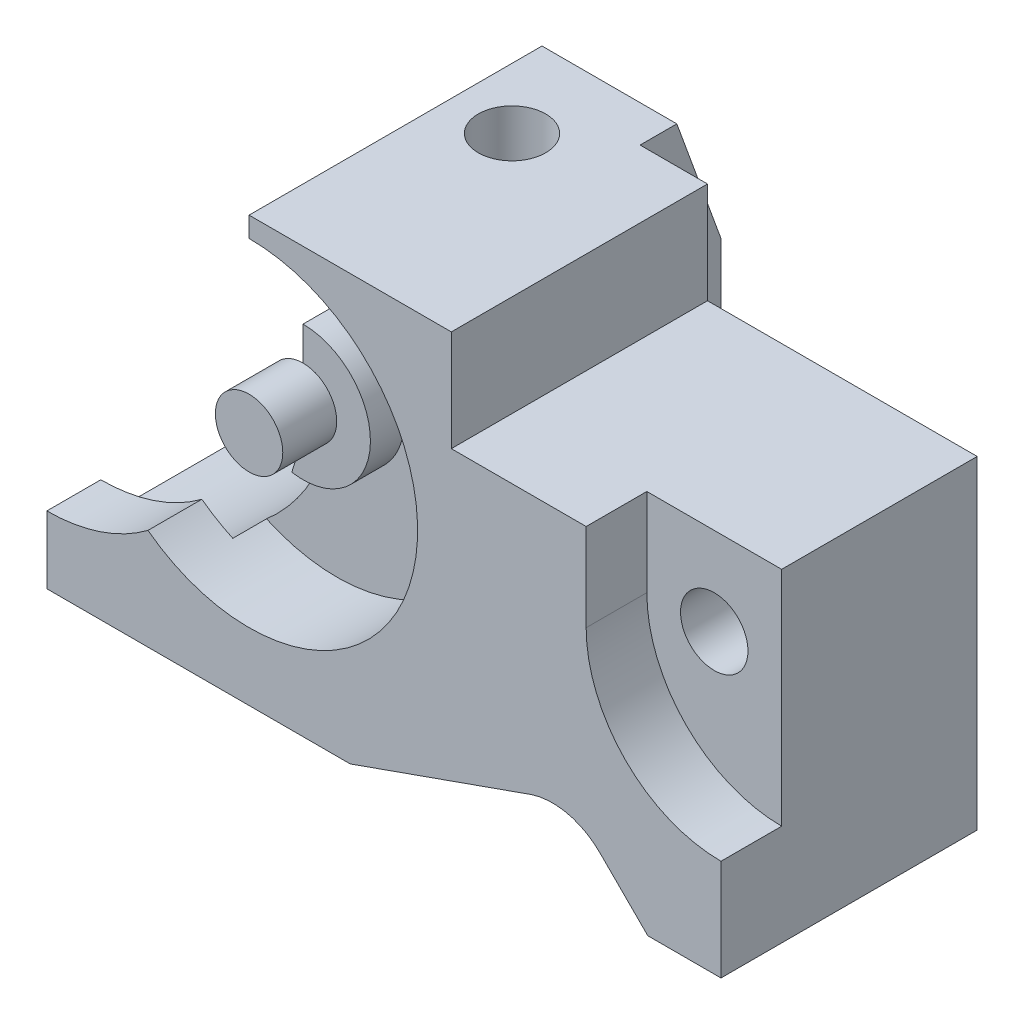
from build123d import *

# Parameters (mm, degrees)
BOSS_EXTRUDE1_DEPTH = 50
SKETCH3_R           = 5
CUT_EXTRUDE1_DEPTH  = 64
CUT_EXTRUDE2_DEPTH  = 9
SKETCH7_R           = 5
CUT_EXTRUDE3_DEPTH  = 82
SKETCH8_W           = 40
SKETCH8_H           = 12
CUT_EXTRUDE4_DEPTH  = 82
SKETCH9_W           = 10
SKETCH9_H           = 12
CUT_EXTRUDE5_DEPTH  = 82
CUT_EXTRUDE6_DEPTH  = 82
SKETCH11_R          = 25
CUT_EXTRUDE7_DEPTH  = 13
BOSS_EXTRUDE2_DEPTH = 8
BOSS_EXTRUDE3_DEPTH = 5
SKETCH14_R          = 5
BOSS_EXTRUDE4_DEPTH = 8


with BuildPart() as part:
    # Sketch1 → Boss-Extrude1 (new body)
    with BuildSketch(Plane.XY):
        with BuildLine():
            Line((0, 5), (0, 0))
            Line((0, 0), (45, 0))
            Line((45, 0), (71.869067897, 9.497224024))
            ThreePointArc((71.869067897, 9.497224024), (77.313595869, 9.728683064), (82.071067812, 7.071067812))
            Line((82.071067812, 7.071067812), (89.142135624, 0))
            Line((89.142135624, 0), (100, 0))
            Line((100, 0), (100, 48))
            Line((100, 48), (60, 48))
            Line((60, 48), (60, 63))
            Line((60, 63), (30, 63))
            Line((30, 63), (30, 35))
            ThreePointArc((30, 35), (21.213203436, 13.786796564), (0, 5))
        make_face()
    extrude(amount=BOSS_EXTRUDE1_DEPTH)

    # Sketch3 → Cut-Extrude1 (cut)
    with BuildSketch(Plane.XY.offset(50)):
        with Locations((90, 35)):
            Circle(SKETCH3_R)
    extrude(amount=-CUT_EXTRUDE1_DEPTH, mode=Mode.SUBTRACT)

    # Sketch6 → Cut-Extrude2 (cut)
    with BuildSketch(Plane.XY.offset(50)):
        with BuildLine():
            Line((80, 48), (100, 48))
            Line((100, 48), (100, 35))
            Line((100, 35), (100, 15))
            ThreePointArc((100, 15), (85.857864376, 20.857864376), (80, 35))
            Line((80, 35), (80, 48))
        make_face()
    extrude(amount=-CUT_EXTRUDE2_DEPTH, mode=Mode.SUBTRACT)

    # Sketch7 → Cut-Extrude3 (cut)
    with BuildSketch(Plane(origin=(0, 63, 0), x_dir=(1, 0, 0), z_dir=(0, 1, 0))):
        with Locations(Location((39, -20, 0), (0, 0, 180))):
            Circle(SKETCH7_R)
    extrude(amount=-CUT_EXTRUDE3_DEPTH, mode=Mode.SUBTRACT)

    # Sketch8 → Cut-Extrude4 (cut)
    with BuildSketch(Plane(origin=(0, 48, 0), x_dir=(1, 0, 0), z_dir=(0, 1, 0))):
        with Locations((80, -6)):
            Rectangle(SKETCH8_W, SKETCH8_H)
    extrude(amount=-CUT_EXTRUDE4_DEPTH, mode=Mode.SUBTRACT)

    # Sketch9 → Cut-Extrude5 (cut)
    with BuildSketch(Plane(origin=(0, 63, 0), x_dir=(1, 0, 0), z_dir=(0, 1, 0))):
        with Locations((55, -6)):
            Rectangle(SKETCH9_W, SKETCH9_H)
    extrude(amount=-CUT_EXTRUDE5_DEPTH, mode=Mode.SUBTRACT)

    # Sketch10 → Cut-Extrude6 (cut)
    with BuildSketch(Plane(origin=(50, 0, 0), x_dir=(0, 0, -1), z_dir=(1, 0, 0))):
        Polygon((0, 63), (0, 45), (-6.551464217, 63), align=None)
    extrude(amount=-CUT_EXTRUDE6_DEPTH, mode=Mode.SUBTRACT)

    # Sketch11 → Cut-Extrude7 (cut)
    with BuildSketch(Plane.XY.offset(50)):
        with Locations((30, 35)):
            Circle(SKETCH11_R)
    extrude(amount=-CUT_EXTRUDE7_DEPTH, mode=Mode.SUBTRACT)

    # Sketch12 → Boss-Extrude2 (add)
    with BuildSketch(Plane.XY.offset(50)):
        with BuildLine():
            ThreePointArc((19.583333333, 12.273516428), (17.218757327, 13.514194553), (15, 15))
            ThreePointArc((15, 15), (7.90569415, 11.282917549), (0, 10))
            Line((0, 10), (0, 5))
            ThreePointArc((0, 5), (10.445226011, 6.877104459), (19.583333333, 12.273516428))
        make_face()
    extrude(amount=-BOSS_EXTRUDE2_DEPTH)

    # Sketch13 → Boss-Extrude3 (add)
    with BuildSketch(Plane.XY.offset(37)):
        with BuildLine():
            ThreePointArc((28.333333333, 25.139867028), (39.964971895, 34.163737397), (30, 45))
            Line((30, 45), (30, 35))
            ThreePointArc((30, 35), (29.580398915, 30), (28.333333333, 25.139867028))
        make_face()
    extrude(amount=BOSS_EXTRUDE3_DEPTH)

    # Sketch14 → Boss-Extrude4 (add)
    with BuildSketch(Plane.XY.offset(42)):
        with Locations(Location((30, 35, 0), (0, 0, 265.219808153))):
            Circle(SKETCH14_R)
    extrude(amount=BOSS_EXTRUDE4_DEPTH)


solid = part.part
